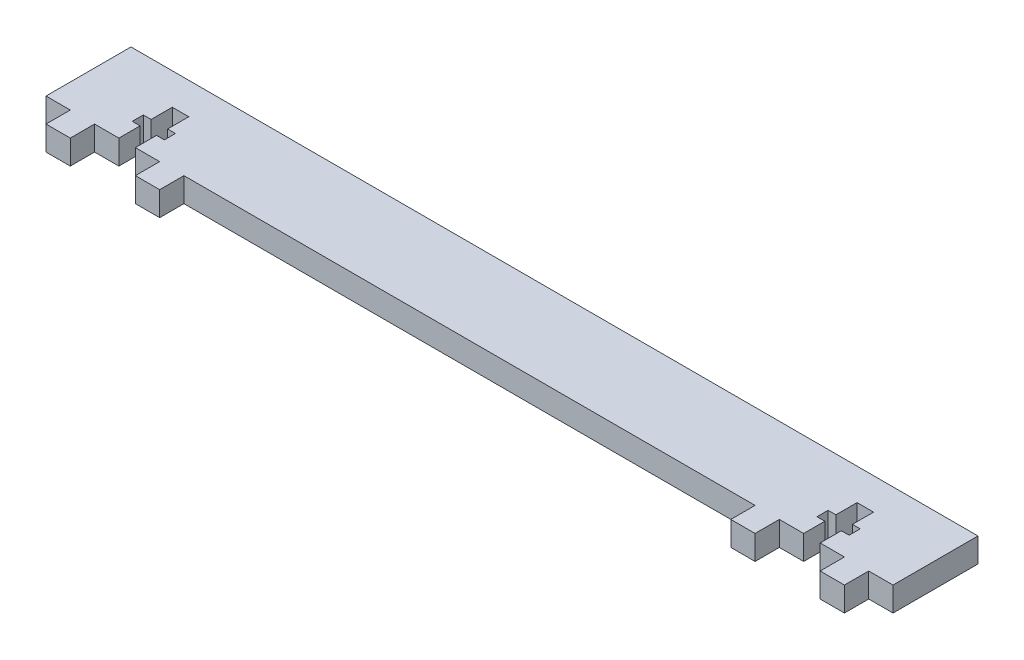
from build123d import *

# Parameters (mm, degrees)
BOSS_EXTRUDE1_DEPTH = 6.35


with BuildPart() as part:
    # Sketch1 → Boss-Extrude1 (new body)
    with BuildSketch(Plane(origin=(0, 0, 0), x_dir=(1, 0, 0), z_dir=(0, 1, 0))):
        Polygon((-110.744, 11.1125), (-110.744, -11.1125), (-104.394, -11.1125), (-104.394, -17.4625), (-98.044, -17.4625), (-98.044, -11.1125), (-91.694, -11.1125), (-91.694, -5.577500021), (-93.734999982, -5.577500021), (-93.734999982, -2.677499979), (-91.694, -2.677499979), (-91.694, 2.8575), (-87.376, 2.8575), (-87.376, -2.677499979), (-85.335000018, -2.677499979), (-85.335000018, -5.577500021), (-87.376, -5.577500021), (-87.376, -11.1125), (-81.026, -11.1125), (-81.026, -17.4625), (-74.676, -17.4625), (-74.676, -11.1125), (74.676, -11.1125), (74.676, -17.4625), (81.026, -17.4625), (81.026, -11.1125), (87.376, -11.1125), (87.376, -5.577500021), (85.335000018, -5.577500021), (85.335000018, -2.677499979), (87.376, -2.677499979), (87.376, 2.8575), (91.694, 2.8575), (91.694, -2.677499979), (93.734999982, -2.677499979), (93.734999982, -5.577500021), (91.694, -5.577500021), (91.694, -11.1125), (98.044, -11.1125), (98.044, -17.4625), (104.394, -17.4625), (104.394, -11.1125), (110.744, -11.1125), (110.744, 11.1125), align=None)
    extrude(amount=BOSS_EXTRUDE1_DEPTH)


solid = part.part
